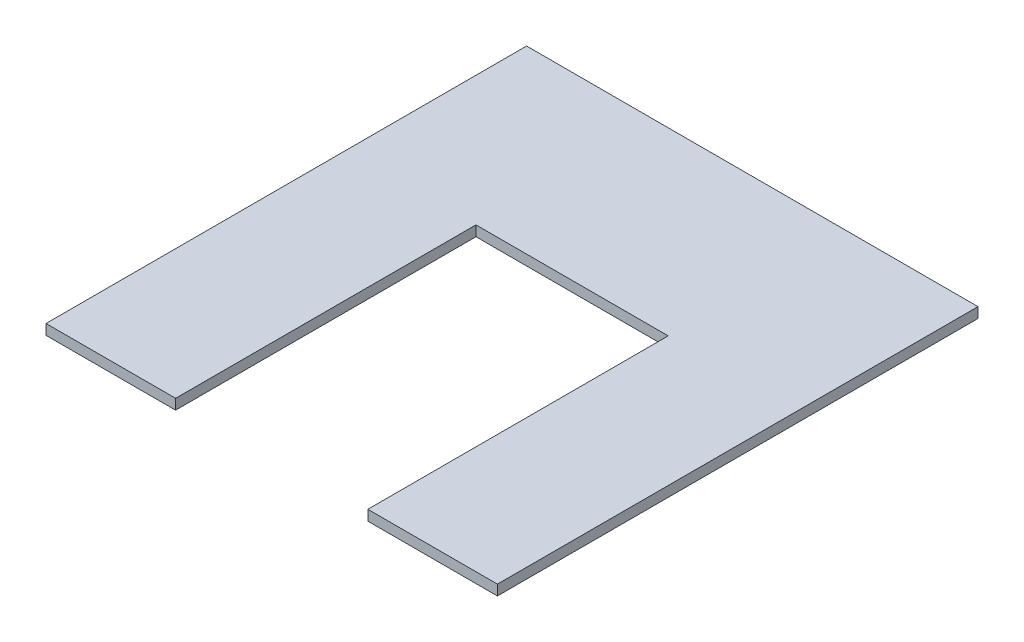
from build123d import *

# Parameters (mm, degrees)
BOSS_EXTRUDE2_DEPTH = 6


with BuildPart() as part:
    # Sketch2 → Boss-Extrude2 (new body)
    with BuildSketch(Plane(origin=(0, 0, 0), x_dir=(1, 0, 0), z_dir=(0, 1, 0))):
        Polygon((22.14932162, 128.939042428), (22.14932162, -151.060957572), (97.64932162, -151.060957572), (97.64932162, 23.939042428), (209.64932162, 23.939042428), (209.64932162, -151.060957572), (285.14932162, -151.060957572), (285.14932162, 128.939042428), align=None)
    extrude(amount=BOSS_EXTRUDE2_DEPTH)


solid = part.part
